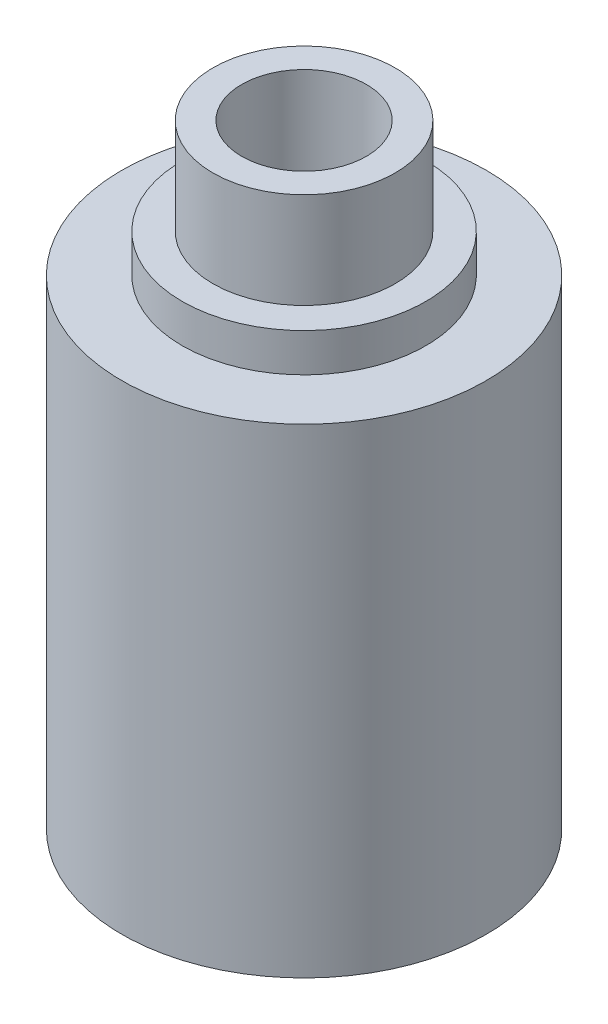
from build123d import *

# Parameters (mm, degrees)
SKETCH_1_R          = 6.35
EXTRUDE_1_DEPTH     = 2
SKETCH_2_R          = 4.75
EXTRUDE_2_DEPTH     = 5
SKETCH_3_R          = 3.25
CUT_EXTRUDE_1_DEPTH = 12.386175829
SKETCH_4_R          = 9.5
EXTRUDE_3_DEPTH     = 25


with BuildPart() as part:
    # 草图1 → 凸台-拉伸1 (new body)
    with BuildSketch(Plane(origin=(0, 0, 0), x_dir=(1, 0, 0), z_dir=(0, 1, 0))):
        with Locations(Location((0, 0, 0), (0, 0, 270))):
            Circle(SKETCH_1_R)
    extrude(amount=EXTRUDE_1_DEPTH)

    # 草图2 → 凸台-拉伸2 (add)
    with BuildSketch(Plane(origin=(0, 2, 0), x_dir=(1, 0, 0), z_dir=(0, 1, 0))):
        with Locations(Location((0, 0, 0), (0, 0, 270))):
            Circle(SKETCH_2_R)
    extrude(amount=EXTRUDE_2_DEPTH)

    # 草图3 → 切除-拉伸1 (cut, through all)
    with BuildSketch(Plane(origin=(0, 7, 0), x_dir=(1, 0, 0), z_dir=(0, 1, 0))):
        with Locations(Location((0, 0, 0), (0, 0, 270))):
            Circle(SKETCH_3_R)
    extrude(amount=-CUT_EXTRUDE_1_DEPTH, mode=Mode.SUBTRACT)

    # 草图4 → 凸台-拉伸3 (add)
    with BuildSketch(Plane.XZ):
        with Locations(Location((0, 0, 0), (0, 0, 270))):
            Circle(SKETCH_4_R)
    extrude(amount=EXTRUDE_3_DEPTH)


solid = part.part
